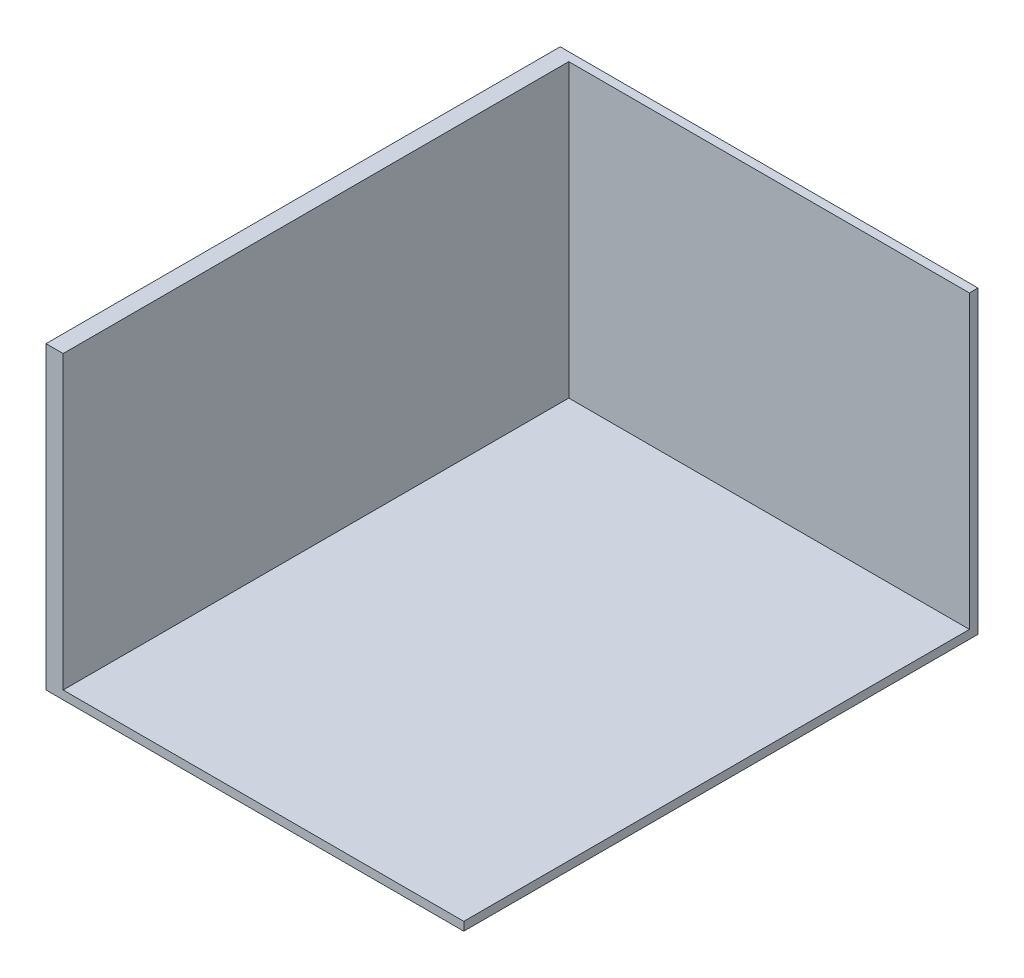
from build123d import *

# Parameters (mm, degrees)
SKETCH_2_W          = 97.5
SKETCH_2_H          = 120
EXTRUDE_2_DEPTH     = 2
SKETCH_3_W          = 97.5
SKETCH_3_H          = 2
EXTRUDE_3_DEPTH     = 68
SKETCH_7_W          = 4
SKETCH_7_H          = 118
EXTRUDE_6_DEPTH     = 68
SKETCH_8_W          = 30.5
SKETCH_8_H          = 30.5
CUT_EXTRUDE_1_DEPTH = 2


with BuildPart() as part:
    # 스케치2 → 보스-돌출2 (new body)
    with BuildSketch(Plane(origin=(0, 0, 0), x_dir=(1, 0, 0), z_dir=(0, 1, 0))):
        Rectangle(SKETCH_2_W, SKETCH_2_H)
    extrude(amount=EXTRUDE_2_DEPTH)

    # 스케치3 → 보스-돌출3 (add)
    with BuildSketch(Plane(origin=(0, 2, 0), x_dir=(1, 0, 0), z_dir=(0, 1, 0))):
        with Locations((0, 59)):
            Rectangle(SKETCH_3_W, SKETCH_3_H)
    extrude(amount=EXTRUDE_3_DEPTH)

    # 스케치7 → 보스-돌출6 (add)
    with BuildSketch(Plane(origin=(0, 2, 0), x_dir=(1, 0, 0), z_dir=(0, 1, 0))):
        with Locations((-46.75, -1)):
            Rectangle(SKETCH_7_W, SKETCH_7_H)
    extrude(amount=EXTRUDE_6_DEPTH)

    # 스케치8 → 컷-돌출1 (cut)
    with BuildSketch(Plane.ZY.offset(48.75)):
        with Locations((0, 16.25)):
            Rectangle(SKETCH_8_W, SKETCH_8_H)
    extrude(amount=-CUT_EXTRUDE_1_DEPTH, mode=Mode.SUBTRACT)


solid = part.part
